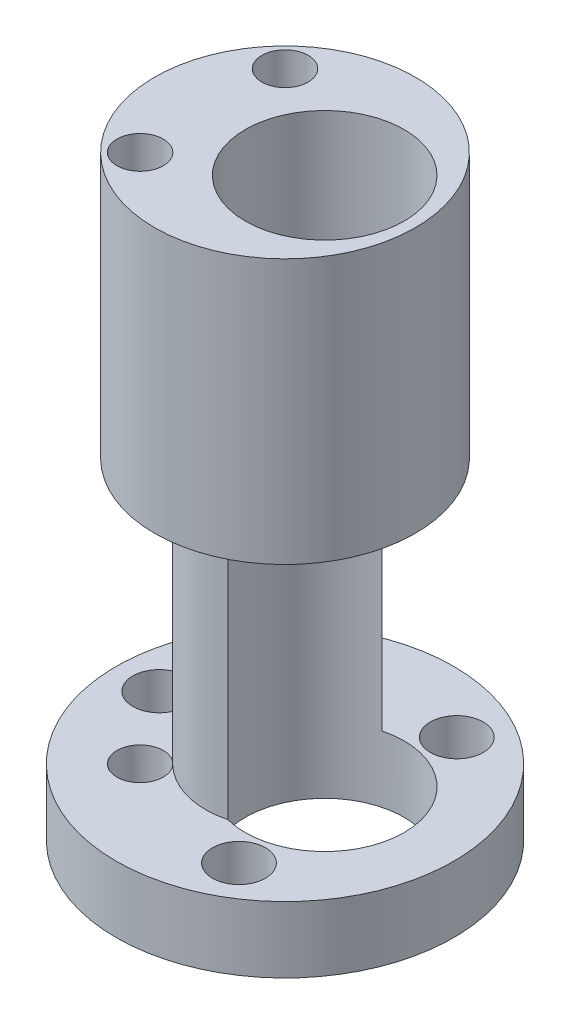
from build123d import *

# Parameters (mm, degrees)
SKETCH1_R                      = 12.75
BOSS_EXTRUDE1_DEPTH            = 5
F_6_0MM_DOWEL_HOLE1_D          = 4
SKETCH2_R                      = 6
BOSS_EXTRUDE2_DEPTH            = 20
SKETCH5_R                      = 9.85
BOSS_EXTRUDE3_DEPTH            = 20
F_6_0MM_DOWEL_HOLE2_D          = 12
F_6_0MM_DOWEL_HOLE3_D          = 3.5
F_6_0MM_DOWEL_HOLE3_DEPTH      = 20
SKETCH17_W                     = 1.75
SKETCH17_H                     = 5
F_6_0MM_DOWEL_HOLE4_AT_2_COUNT = 2
F_6_0MM_DOWEL_HOLE4_AT_2_PITCH = 10.946012973


with BuildPart() as part:
    # Sketch1 → Boss-Extrude1 (new body)
    with BuildSketch(Plane(origin=(0, 0, 0), x_dir=(1, 0, 0), z_dir=(0, 1, 0))):
        with Locations(Location((0, 0, 0), (0, 0, 270))):
            Circle(SKETCH1_R)
    extrude(amount=BOSS_EXTRUDE1_DEPTH)

    # Ø6.0mm Dowel Hole1 (through all)
    with Locations(Plane(origin=(0, 5, 0), x_dir=(1, 0, 0), z_dir=(0, 1, 0))):
        with Locations((-9.5, 0), (4.75, -8.227241336), (4.75, 8.227241336)):
            Hole(F_6_0MM_DOWEL_HOLE1_D / 2)

    # Sketch2 → Boss-Extrude2 (add)
    with BuildSketch(Plane(origin=(0, 5, 0), x_dir=(1, 0, 0), z_dir=(0, 1, 0))):
        with Locations(Location((0, 0, 0), (0, 0, 270))):
            Circle(SKETCH2_R)
    extrude(amount=BOSS_EXTRUDE2_DEPTH)

    # Sketch5 → Boss-Extrude3 (add)
    with BuildSketch(Plane(origin=(0, 25, 0), x_dir=(1, 0, 0), z_dir=(0, 1, 0))):
        with Locations(Location((0, 0, 0), (0, 0, 270))):
            Circle(SKETCH5_R)
    extrude(amount=BOSS_EXTRUDE3_DEPTH)

    # Ø6.0mm Dowel Hole2 (through all)
    with Locations(Plane(origin=(0, 45, 0), x_dir=(1, 0, 0), z_dir=(0, 1, 0))):
        with Locations((3, 0)):
            Hole(F_6_0MM_DOWEL_HOLE2_D / 2)

    # Ø6.0mm Dowel Hole3
    with Locations(Plane(origin=(0, 45, 0), x_dir=(1, 0, 0), z_dir=(0, 1, 0))):
        with Locations((-5.473006486, 5.473006486), (-5.473006486, -5.473006486)):
            Hole(F_6_0MM_DOWEL_HOLE3_D / 2, depth=F_6_0MM_DOWEL_HOLE3_DEPTH)

    # Sketch17 → Ø6.0mm Dowel Hole4 (revolve, cut)
    with BuildSketch(Plane(origin=(-5.473006486, 5, 5.473006486), x_dir=(0, 0, 1), z_dir=(1, 0, 0))):
        with Locations((0.875, 2.5)):
            Rectangle(SKETCH17_W, SKETCH17_H)
    f_6_0mm_dowel_hole4 = revolve(axis=Axis((-5.473006486, 11.35, 5.473006486), (0, -1, 0)), mode=Mode.SUBTRACT)

    # Ø6.0mm Dowel Hole4 at 2: Ø6.0mm Dowel Hole4 ×2
    with Locations(*[(0, 0, -i * F_6_0MM_DOWEL_HOLE4_AT_2_PITCH) for i in range(1, F_6_0MM_DOWEL_HOLE4_AT_2_COUNT)]):
        add(f_6_0mm_dowel_hole4, mode=Mode.SUBTRACT)


solid = part.part
